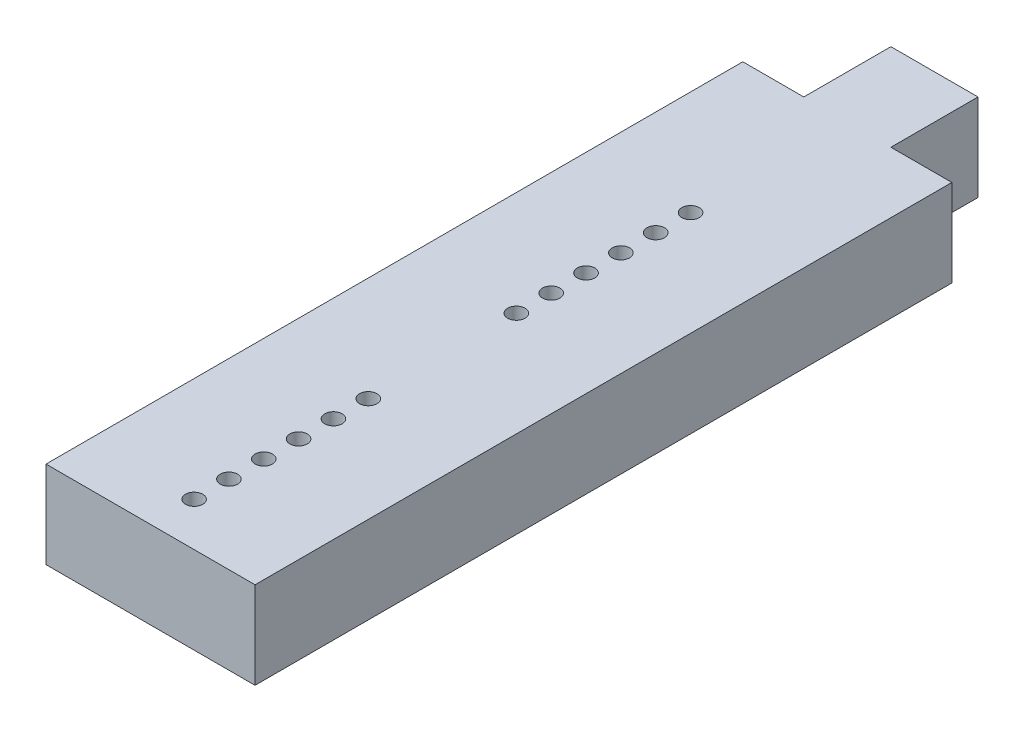
from build123d import *

# Parameters (mm, degrees)
SKETCH1_R           = 0.5
BOSS_EXTRUDE1_DEPTH = 5


with BuildPart() as part:
    # Sketch1 → Boss-Extrude1 (new body)
    with BuildSketch(Plane(origin=(0, 0, 0), x_dir=(1, 0, 0), z_dir=(0, 1, 0))):
        Polygon((-2.5, 20), (-2.5, 25), (2.5, 25), (2.5, 20), (6, 20), (6, -20), (-6, -20), (-6, 20), align=None)
        with Locations(Location((0, 11, 0), (0, 0, 270))):
            Circle(SKETCH1_R, mode=Mode.SUBTRACT)
        with Locations(Location((0, 9, 0), (0, 0, 270))):
            Circle(SKETCH1_R, mode=Mode.SUBTRACT)
        with Locations(Location((0, 7, 0), (0, 0, 270))):
            Circle(SKETCH1_R, mode=Mode.SUBTRACT)
        with Locations(Location((0, 5, 0), (0, 0, 270))):
            Circle(SKETCH1_R, mode=Mode.SUBTRACT)
        with Locations(Location((0, 3, 0), (0, 0, 270))):
            Circle(SKETCH1_R, mode=Mode.SUBTRACT)
        with Locations(Location((0, 1, 0), (0, 0, 270))):
            Circle(SKETCH1_R, mode=Mode.SUBTRACT)
        with Locations(Location((0, -7.5, 0), (0, 0, 270))):
            Circle(SKETCH1_R, mode=Mode.SUBTRACT)
        with Locations(Location((0, -9.5, 0), (0, 0, 270))):
            Circle(SKETCH1_R, mode=Mode.SUBTRACT)
        with Locations(Location((0, -11.5, 0), (0, 0, 270))):
            Circle(SKETCH1_R, mode=Mode.SUBTRACT)
        with Locations(Location((0, -13.5, 0), (0, 0, 270))):
            Circle(SKETCH1_R, mode=Mode.SUBTRACT)
        with Locations(Location((0, -15.5, 0), (0, 0, 270))):
            Circle(SKETCH1_R, mode=Mode.SUBTRACT)
        with Locations(Location((0, -17.5, 0), (0, 0, 270))):
            Circle(SKETCH1_R, mode=Mode.SUBTRACT)
    extrude(amount=BOSS_EXTRUDE1_DEPTH)


solid = part.part
